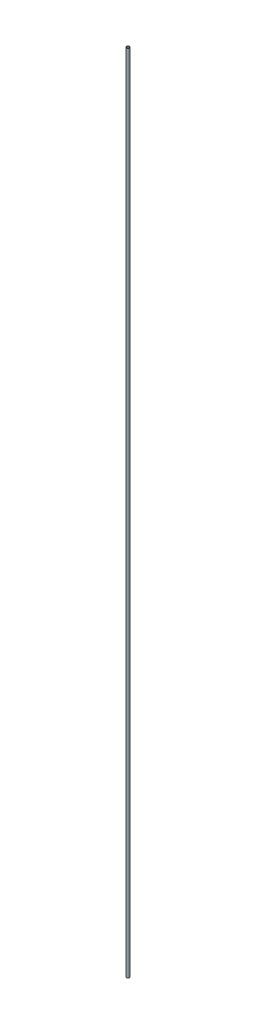
from build123d import *

# Parameters (mm, degrees)
SKETCH1_R           = 1.5
SKETCH1_R_2         = 1.25
BOSS_EXTRUDE1_DEPTH = 800


with BuildPart() as part:
    # Sketch1 → Boss-Extrude1 (new body)
    with BuildSketch(Plane(origin=(0, 0, 0), x_dir=(1, 0, 0), z_dir=(0, 1, 0))):
        with Locations(Location((0, 0, 0), (0, 0, 270))):
            Circle(SKETCH1_R)
        with Locations(Location((0, 0, 0), (0, 0, 270))):
            Circle(SKETCH1_R_2, mode=Mode.SUBTRACT)
    extrude(amount=BOSS_EXTRUDE1_DEPTH)


solid = part.part
